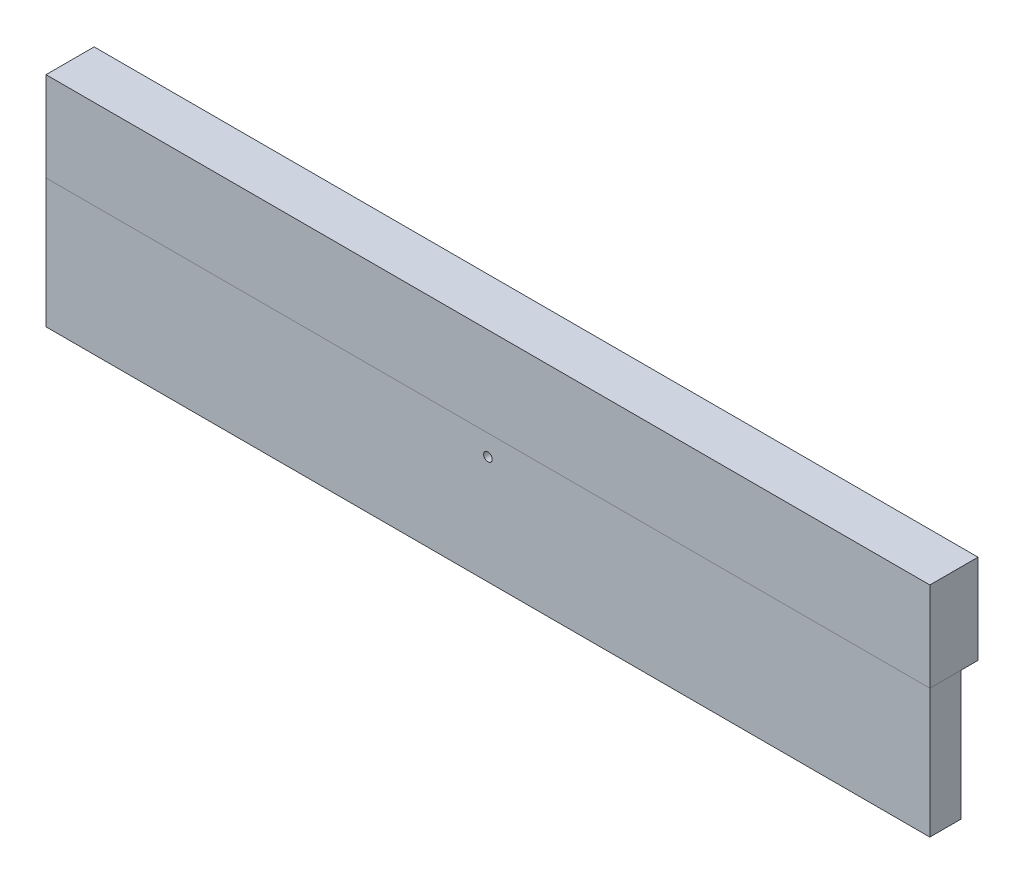
from build123d import *

# Parameters (mm, degrees)
SKETCH1_3_W         = 514
SKETCH1_3_H         = 52
BOSS_EXTRUDE2_DEPTH = 9
BOSS_EXTRUDE3_START = -19
SKETCH1_4_W         = 514
SKETCH1_4_H         = 52
BOSS_EXTRUDE3_DEPTH = 10
SKETCH1_W           = 514
SKETCH1_H           = 75
SKETCH1_R           = 2.5
BOSS_EXTRUDE1_DEPTH = 9


with BuildPart() as part:
    # Sketch1<3> → Boss-Extrude2 (new, symmetric)
    with BuildSketch(Plane.XY):
        with Locations((0, 63.5)):
            Rectangle(SKETCH1_3_W, SKETCH1_3_H)
    extrude(amount=BOSS_EXTRUDE2_DEPTH, both=True)

    # Sketch1<4> → Boss-Extrude3 (add)
    with BuildSketch(Plane.XY.offset(BOSS_EXTRUDE3_START)):
        with Locations((0, 63.5)):
            Rectangle(SKETCH1_4_W, SKETCH1_4_H)
        with Locations((0, 63.5)):
            Rectangle(SKETCH1_4_W, SKETCH1_4_H)
    extrude(amount=BOSS_EXTRUDE3_DEPTH)


with BuildPart() as body_2:
    # Sketch1 → Boss-Extrude1 (new, symmetric)
    with BuildSketch(Plane.XY):
        Rectangle(SKETCH1_W, SKETCH1_H)
        with Locations((0, 25.5)):
            Circle(SKETCH1_R, mode=Mode.SUBTRACT)
    extrude(amount=BOSS_EXTRUDE1_DEPTH, both=True)


solid = Compound([part.part, body_2.part])
